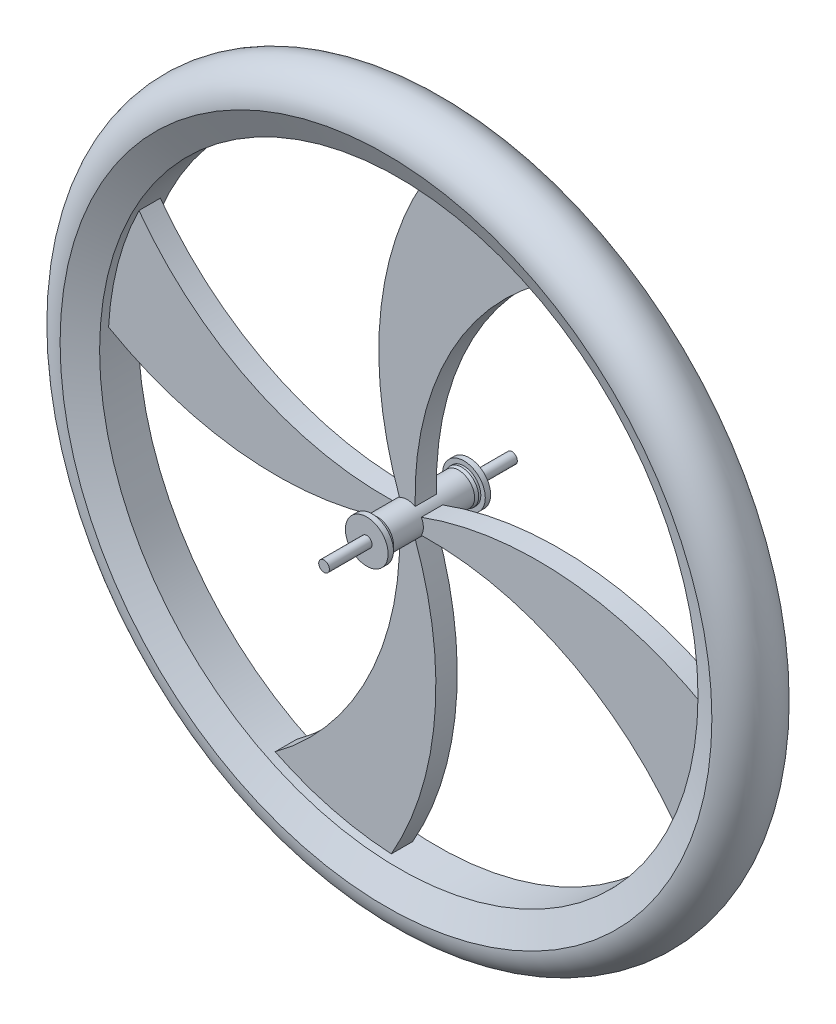
from build123d import *

# Parameters (mm, degrees)
SKETCH1_R            = 15
BOSS_EXTRUDE1_DEPTH  = 38
SKETCH2_R            = 15
BOSS_EXTRUDE2_DEPTH  = 3
BOSS_EXTRUDE2_DRAFT  = -15
SKETCH3_R            = 15.803847577
BOSS_EXTRUDE3_DEPTH  = 2
SKETCH4_R            = 20
BOSS_EXTRUDE4_DEPTH  = 5
SKETCH5_R            = 5
BOSS_EXTRUDE5_DEPTH  = 40
BOSS_EXTRUDE14_DEPTH = 10


with BuildPart() as part:
    # Sketch1 → Boss-Extrude1 (new body)
    with BuildSketch(Plane.XY):
        Circle(SKETCH1_R)
    extrude(amount=BOSS_EXTRUDE1_DEPTH)


with BuildPart() as boss_extrude2_tool:
    # Sketch2 → Boss-Extrude2 (with draft: the straight prism first)
    with BuildSketch(Plane.XY.offset(38)):
        Circle(SKETCH2_R)
    extrude(amount=BOSS_EXTRUDE2_DEPTH)
    # Boss-Extrude2: the draft: its side faces are tilted about the plane it starts from
    boss_extrude2_sides = [boss_extrude2_tool.faces().sort_by_distance(p)[0] for p in [
        (-15, 0, 39.5),
    ]]
    draft(boss_extrude2_sides, Plane.XY.offset(38), BOSS_EXTRUDE2_DRAFT)


with BuildPart() as part_1:
    add(part.part)

    # Boss-Extrude2: add boss_extrude2_tool
    add(boss_extrude2_tool.part)

    # Sketch3 → Boss-Extrude3 (add)
    with BuildSketch(Plane.XY.offset(41)):
        Circle(SKETCH3_R)
    extrude(amount=BOSS_EXTRUDE3_DEPTH)

    # Sketch4 → Boss-Extrude4 (add)
    with BuildSketch(Plane.XY.offset(43)):
        Circle(SKETCH4_R)
    extrude(amount=BOSS_EXTRUDE4_DEPTH)

    # Sketch5 → Boss-Extrude5 (add)
    with BuildSketch(Plane.XY.offset(48)):
        Circle(SKETCH5_R)
    extrude(amount=BOSS_EXTRUDE5_DEPTH)

    # Mirror1: part across plane


with BuildPart() as part_2:
    add(part_1.part)
    add(part_1.part.mirror(Plane.XY))



with BuildPart() as body_2:
    # Sketch6 → Revolve1 (revolve)
    with BuildSketch(Plane(origin=(0, 0, 0), x_dir=(0, 0, -1), z_dir=(1, 0, 0)), mode=Mode.PRIVATE) as revolve1_sk:
        Polygon((-30, 305.2), (30, 305.2), (18, 280.2), (-18, 280.2), align=None)
    revolve(revolve1_sk.sketch.rotate(Axis((0, 0, 38), (0, 0, -1)), 90), axis=Axis((0, 0, 38), (0, 0, -1)))


with BuildPart() as part_3:
    add(part_2.part)

    add(body_2.part)  # Boss-Extrude14 merges body 2
    # Sketch7 → Boss-Extrude14 (add, symmetric)
    with BuildSketch(Plane.XY):
        with BuildLine():
            ThreePointArc((-7.320383178, 13.09244019), (-25.622638941, 148.911014187), (15, 279.798213004))
            ThreePointArc((15, 279.798213004), (70.845559028, 271.0958258), (123.808589933, 251.363229329))
            ThreePointArc((123.808589933, 251.363229329), (36.300695478, 146.53460966), (7.320383178, 13.09244019))
            ThreePointArc((7.320383178, 13.09244019), (0, 15), (-7.320383178, 13.09244019))
        make_face()
        with BuildLine():
            ThreePointArc((13.09244019, 7.320383178), (148.911014187, 25.622638941), (279.798213004, -15))
            ThreePointArc((279.798213004, -15), (271.0958258, -70.845559028), (251.363229329, -123.808589933))
            ThreePointArc((251.363229329, -123.808589933), (146.53460966, -36.300695478), (13.09244019, -7.320383178))
            ThreePointArc((13.09244019, -7.320383178), (15, 0), (13.09244019, 7.320383178))
        make_face()
        with BuildLine():
            ThreePointArc((7.320383178, -13.09244019), (25.622638941, -148.911014187), (-15, -279.798213004))
            ThreePointArc((-15, -279.798213004), (-70.845559028, -271.0958258), (-123.808589933, -251.363229329))
            ThreePointArc((-123.808589933, -251.363229329), (-36.300695478, -146.53460966), (-7.320383178, -13.09244019))
            ThreePointArc((-7.320383178, -13.09244019), (0, -15), (7.320383178, -13.09244019))
        make_face()
        with BuildLine():
            ThreePointArc((-13.09244019, -7.320383178), (-148.911014187, -25.622638941), (-279.798213004, 15))
            ThreePointArc((-279.798213004, 15), (-271.0958258, 70.845559028), (-251.363229329, 123.808589933))
            ThreePointArc((-251.363229329, 123.808589933), (-146.53460966, 36.300695478), (-13.09244019, 7.320383178))
            ThreePointArc((-13.09244019, 7.320383178), (-15, 0), (-13.09244019, -7.320383178))
        make_face()
    extrude(amount=BOSS_EXTRUDE14_DEPTH, both=True)

    # Sketch8 → Revolve2 (revolve)
    with BuildSketch(Plane(origin=(0, 0, 0), x_dir=(1, 0, 0), z_dir=(0, 1, 0))):
        with BuildLine():
            Line((305.2, 30), (305.2, -30))
            ThreePointArc((305.2, -30), (335.2, 0), (305.2, 30))
        make_face()
    revolve(axis=Axis((0, 0, 38), (0, 0, -1)))


solid = part_3.part
